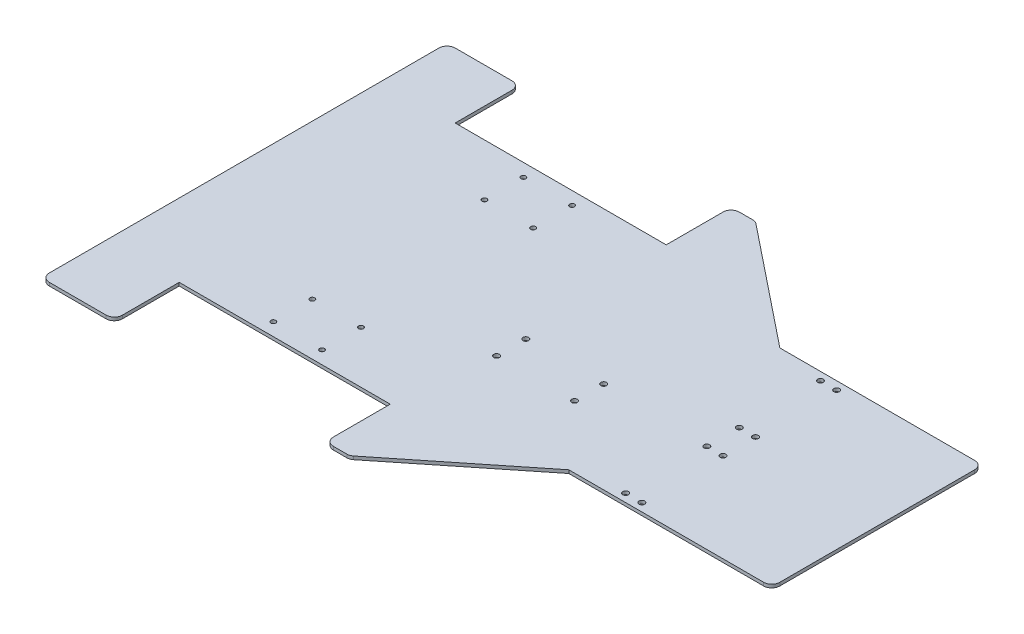
from build123d import *

# Parameters (mm, degrees)
SKETCH_1_W          = 390
SKETCH_1_H          = 250
EXTRUDE_1_DEPTH     = 2
SKETCH_2_W          = 130
SKETCH_2_H          = 40
SKETCH_2_W_2        = 125
SKETCH_2_H_2        = 60
CUT_EXTRUDE_1_DEPTH = 5
CUT_EXTRUDE_2_DEPTH = 10
FILLET_1_R          = 5
SKETCH_4_R          = 1.5
SKETCH_4_R_2        = 1.75
CUT_EXTRUDE_3_DEPTH = 232.633330935
SKETCH_5_R          = 1.75
CUT_EXTRUDE_4_DEPTH = 232.633330935


with BuildPart() as part:
    # 스케치1 → 보스-돌출1 (new body)
    with BuildSketch(Plane(origin=(0, 0, 0), x_dir=(1, 0, 0), z_dir=(0, 1, 0))):
        Rectangle(SKETCH_1_W, SKETCH_1_H)
    extrude(amount=EXTRUDE_1_DEPTH)

    # 스케치2 → 컷-돌출1 (cut)
    with BuildSketch(Plane(origin=(0, 2, 0), x_dir=(1, 0, 0), z_dir=(0, 1, 0))):
        with Locations((-85, 105)):
            Rectangle(SKETCH_2_W, SKETCH_2_H)
        with Locations((-85, -105)):
            Rectangle(SKETCH_2_W, SKETCH_2_H)
        with Locations((132.5, 95)):
            Rectangle(SKETCH_2_W_2, SKETCH_2_H_2)
        with Locations((132.5, -95)):
            Rectangle(SKETCH_2_W_2, SKETCH_2_H_2)
    extrude(amount=-CUT_EXTRUDE_1_DEPTH, mode=Mode.SUBTRACT)

    # 스케치3 → 컷-돌출2 (cut)
    with BuildSketch(Plane(origin=(0, 2, 0), x_dir=(1, 0, 0), z_dir=(0, 1, 0))):
        Polygon((-5, 125), (70, 65), (70, 125), align=None)
        Polygon((70, -65), (-5, -125), (70, -125), align=None)
    extrude(amount=-CUT_EXTRUDE_2_DEPTH, mode=Mode.SUBTRACT)

    # 필렛1
    fillet_1_edges = [part.edges().sort_by_distance(p)[0] for p in [
        (-5, 1, -125),
        (-5, 1, 125),
        (-150, 1, 125),
        (-20, 1, 125),
        (195, 1, -65),
        (195, 1, 65),
        (-150, 1, -125),
        (-20, 1, -125),
        (-195, 1, 125),
        (-195, 1, -125),
    ]]
    fillet(fillet_1_edges, radius=FILLET_1_R)

    # 스케치4 → 컷-돌출3 (cut, through all)
    with BuildSketch(Plane(origin=(0, 2, 0), x_dir=(1, 0, 0), z_dir=(0, 1, 0))):
        with Locations(Location((-100, 77, 0), (0, 0, 270))):
            Circle(SKETCH_4_R)
        with Locations(Location((-70, 77, 0), (0, 0, 270))):
            Circle(SKETCH_4_R)
        with Locations(Location((-70, 53, 0), (0, 0, 270))):
            Circle(SKETCH_4_R)
        with Locations(Location((-100, 53, 0), (0, 0, 270))):
            Circle(SKETCH_4_R)
        with Locations(Location((-100, -53, 0), (0, 0, 90))):
            Circle(SKETCH_4_R)
        with Locations(Location((-70, -53, 0), (0, 0, 90))):
            Circle(SKETCH_4_R)
        with Locations(Location((-70, -77, 0), (0, 0, 90))):
            Circle(SKETCH_4_R)
        with Locations(Location((-100, -77, 0), (0, 0, 90))):
            Circle(SKETCH_4_R)
        with Locations(Location((100, 60, 0), (0, 0, 270))):
            Circle(SKETCH_4_R_2)
        with Locations(Location((110, 60, 0), (0, 0, 270))):
            Circle(SKETCH_4_R_2)
        with Locations(Location((100, 10, 0), (0, 0, 270))):
            Circle(SKETCH_4_R_2)
        with Locations(Location((110, 10, 0), (0, 0, 270))):
            Circle(SKETCH_4_R_2)
        with Locations(Location((100, -10, 0), (0, 0, 270))):
            Circle(SKETCH_4_R_2)
        with Locations(Location((110, -10, 0), (0, 0, 270))):
            Circle(SKETCH_4_R_2)
        with Locations(Location((100, -60, 0), (0, 0, 270))):
            Circle(SKETCH_4_R_2)
        with Locations(Location((110, -60, 0), (0, 0, 270))):
            Circle(SKETCH_4_R_2)
    extrude(amount=-CUT_EXTRUDE_3_DEPTH, mode=Mode.SUBTRACT)

    # 스케치5 → 컷-돌출4 (cut, through all)
    with BuildSketch(Plane(origin=(0, 2, 0), x_dir=(1, 0, 0), z_dir=(0, 1, 0))):
        with Locations(Location((-13, -8.5, 0), (0, 0, 270))):
            Circle(SKETCH_5_R)
        with Locations(Location((35, -8.5, 0), (0, 0, 270))):
            Circle(SKETCH_5_R)
        with Locations(Location((-13, -26.5, 0), (0, 0, 270))):
            Circle(SKETCH_5_R)
        with Locations(Location((35, -26.5, 0), (0, 0, 270))):
            Circle(SKETCH_5_R)
    extrude(amount=-CUT_EXTRUDE_4_DEPTH, mode=Mode.SUBTRACT)


solid = part.part
